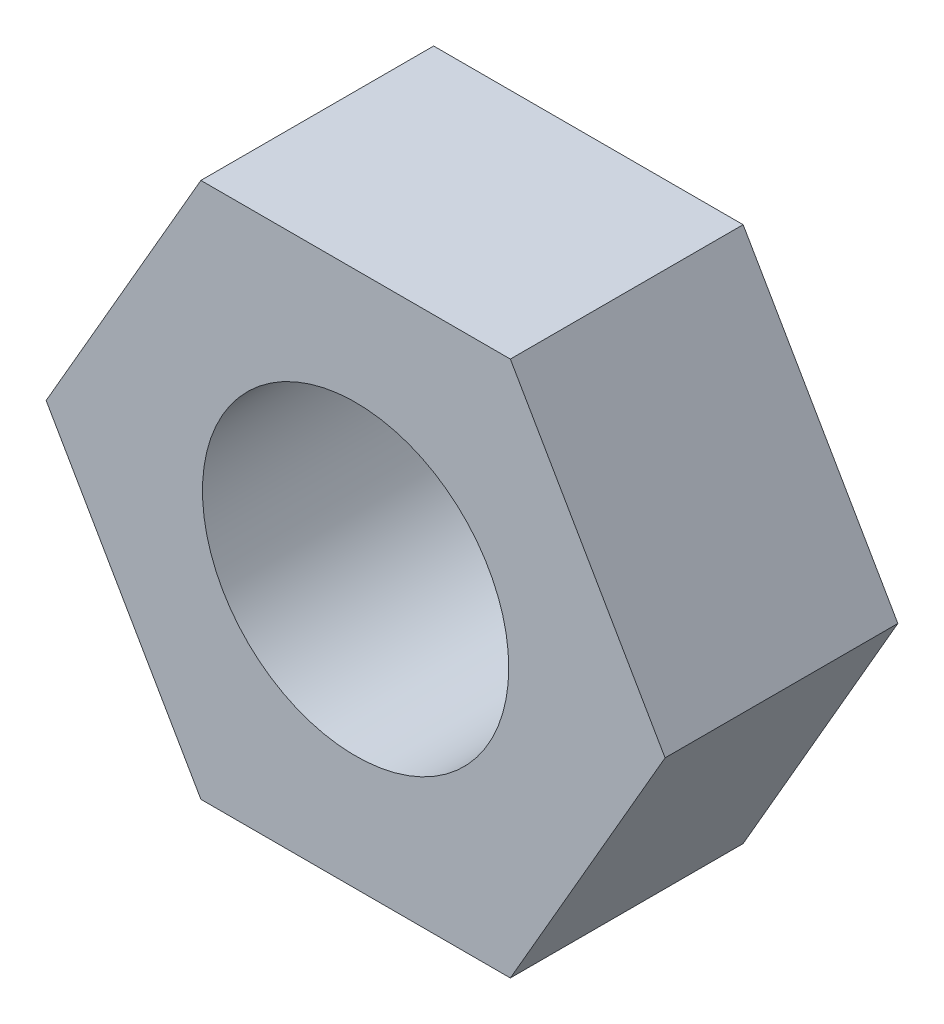
from build123d import *

# Parameters (mm, degrees)
BOSS_EXTRUDE1_DEPTH = 4.826
SKETCH2_R           = 3.175
CUT_EXTRUDE1_DEPTH  = 10.763439053


with BuildPart() as part:
    # Sketch1 → Boss-Extrude1 (new body)
    with BuildSketch(Plane.XY):
        Polygon((-6.415804866, 0), (-3.207902433, -5.55625), (3.207902433, -5.55625), (6.415804866, 0), (3.207902433, 5.55625), (-3.207902433, 5.55625), align=None)
    extrude(amount=BOSS_EXTRUDE1_DEPTH)

    # Sketch2 → Cut-Extrude1 (cut, through all)
    with BuildSketch(Plane.XY.offset(4.826)):
        Circle(SKETCH2_R)
    extrude(amount=-CUT_EXTRUDE1_DEPTH, mode=Mode.SUBTRACT)


solid = part.part
